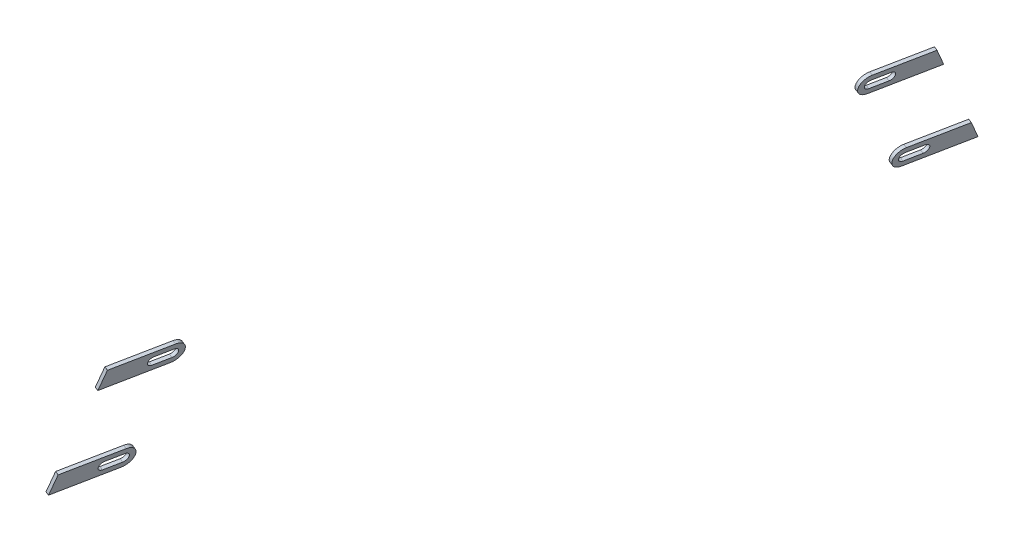
from build123d import *

# Parameters (mm, degrees)
BOSS_EXTRUDE1_DEPTH = 2
BOSS_EXTRUDE2_DEPTH = 2
BOSS_EXTRUDE3_DEPTH = 2
BOSS_EXTRUDE4_DEPTH = 2


with BuildPart() as part:
    # Sketch2 → Boss-Extrude1 (new body)
    with BuildSketch(Plane(origin=(-659.614198676, 210.630673215, -131.193827815), x_dir=(-0.17733557040624798, 0.05662751143705045, 0.9825199338523047), z_dir=(-0.9359591821601213, 0.2988742708017777, -0.18615740539356104))):
        with BuildLine():
            Line((-1762.428644659, 444.179865311), (-1724.642420311, 441.93367757))
            ThreePointArc((-1724.642420311, 441.93367757), (-1718.296954075, 447.567065382), (-1723.930341887, 453.912531618))
            Line((-1723.930341887, 453.912531618), (-1756.020766156, 455.820134689))
            Line((-1756.020766156, 455.820134689), (-1762.428644659, 444.179865311))
        make_face()
        with BuildLine():
            Line((-1734.105574834, 451.261657334), (-1724.12319646, 450.668258647))
            ThreePointArc((-1724.12319646, 450.668258647), (-1721.541227046, 447.759919955), (-1724.449565738, 445.177950541))
            Line((-1724.449565738, 445.177950541), (-1734.431944112, 445.771349229))
            ThreePointArc((-1734.431944112, 445.771349229), (-1737.013913526, 448.67968792), (-1734.105574834, 451.261657334))
        make_face(mode=Mode.SUBTRACT)
    extrude(amount=BOSS_EXTRUDE1_DEPTH)


with BuildPart() as body_2:
    # Sketch4 → Boss-Extrude2 (new body)
    with BuildSketch(Plane(origin=(-659.614198676, 210.630673215, -131.193827815), x_dir=(-0.17733557040624798, 0.05662751143705045, 0.9825199338523047), z_dir=(-0.9359591821601213, 0.2988742708017777, -0.18615740539356104))):
        with BuildLine():
            Line((-1789.050303331, 395.820134689), (-1756.898203369, 393.90886533))
            ThreePointArc((-1756.898203369, 393.90886533), (-1751.264815558, 387.563399094), (-1757.610281794, 381.930011282))
            Line((-1757.610281794, 381.930011282), (-1795.458181833, 384.179865311))
            Line((-1795.458181833, 384.179865311), (-1789.050303331, 395.820134689))
        make_face()
        with BuildLine():
            Line((-1767.073436317, 391.257991046), (-1757.091057943, 390.664592359))
            ThreePointArc((-1757.091057943, 390.664592359), (-1754.509088529, 387.756253667), (-1757.417427221, 385.174284253))
            Line((-1757.417427221, 385.174284253), (-1767.399805595, 385.767682941))
            ThreePointArc((-1767.399805595, 385.767682941), (-1769.981775008, 388.676021632), (-1767.073436317, 391.257991046))
        make_face(mode=Mode.SUBTRACT)
    extrude(amount=BOSS_EXTRUDE2_DEPTH)


with BuildPart() as body_3:
    # Sketch5 → Boss-Extrude3 (new body)
    with BuildSketch(Plane(origin=(-659.614198676, 210.630673215, -131.193827815), x_dir=(-0.17733557040624798, 0.05662751143705045, 0.9825199338523047), z_dir=(-0.9359591821601213, 0.2988742708017777, -0.18615740539356104))):
        with BuildLine():
            Line((-1344.593499783, 431.362997252), (-1342.95576952, 419.244459719))
            Line((-1342.95576952, 419.244459719), (-1379.068998172, 421.391196867))
            ThreePointArc((-1379.068998172, 421.391196867), (-1384.702385984, 427.736663104), (-1378.356919747, 433.370050916))
            Line((-1378.356919747, 433.370050916), (-1344.593499783, 431.362997252))
        make_face()
        with BuildLine():
            Line((-1378.54977432, 430.125777944), (-1368.567395947, 429.532379257))
            ThreePointArc((-1368.567395947, 429.532379257), (-1365.985426533, 426.624040565), (-1368.893765225, 424.042071151))
            Line((-1368.893765225, 424.042071151), (-1378.876143599, 424.635469839))
            ThreePointArc((-1378.876143599, 424.635469839), (-1381.458113012, 427.543808531), (-1378.54977432, 430.125777944))
        make_face(mode=Mode.SUBTRACT)
    extrude(amount=BOSS_EXTRUDE3_DEPTH)


with BuildPart() as body_4:
    # Sketch6 → Boss-Extrude4 (new body)
    with BuildSketch(Plane(origin=(-659.614198676, 210.630673215, -131.193827815), x_dir=(-0.17733557040624798, 0.05662751143705045, 0.9825199338523047), z_dir=(-0.9359591821601213, 0.2988742708017777, -0.18615740539356104))):
        with BuildLine():
            Line((-1336.151786573, 368.897754539), (-1334.51405631, 356.779217006))
            Line((-1334.51405631, 356.779217006), (-1370.627284962, 358.925954154))
            ThreePointArc((-1370.627284962, 358.925954154), (-1376.260672774, 365.271420391), (-1369.915206537, 370.904808203))
            Line((-1369.915206537, 370.904808203), (-1336.151786573, 368.897754539))
        make_face()
        with BuildLine():
            Line((-1370.10806111, 367.660535231), (-1360.125682737, 367.067136544))
            ThreePointArc((-1360.125682737, 367.067136544), (-1357.543713323, 364.158797852), (-1360.452052015, 361.576828438))
            Line((-1360.452052015, 361.576828438), (-1370.434430388, 362.170227126))
            ThreePointArc((-1370.434430388, 362.170227126), (-1373.016399802, 365.078565818), (-1370.10806111, 367.660535231))
        make_face(mode=Mode.SUBTRACT)
    extrude(amount=BOSS_EXTRUDE4_DEPTH)


solid = Compound([part.part, body_2.part, body_3.part, body_4.part])
